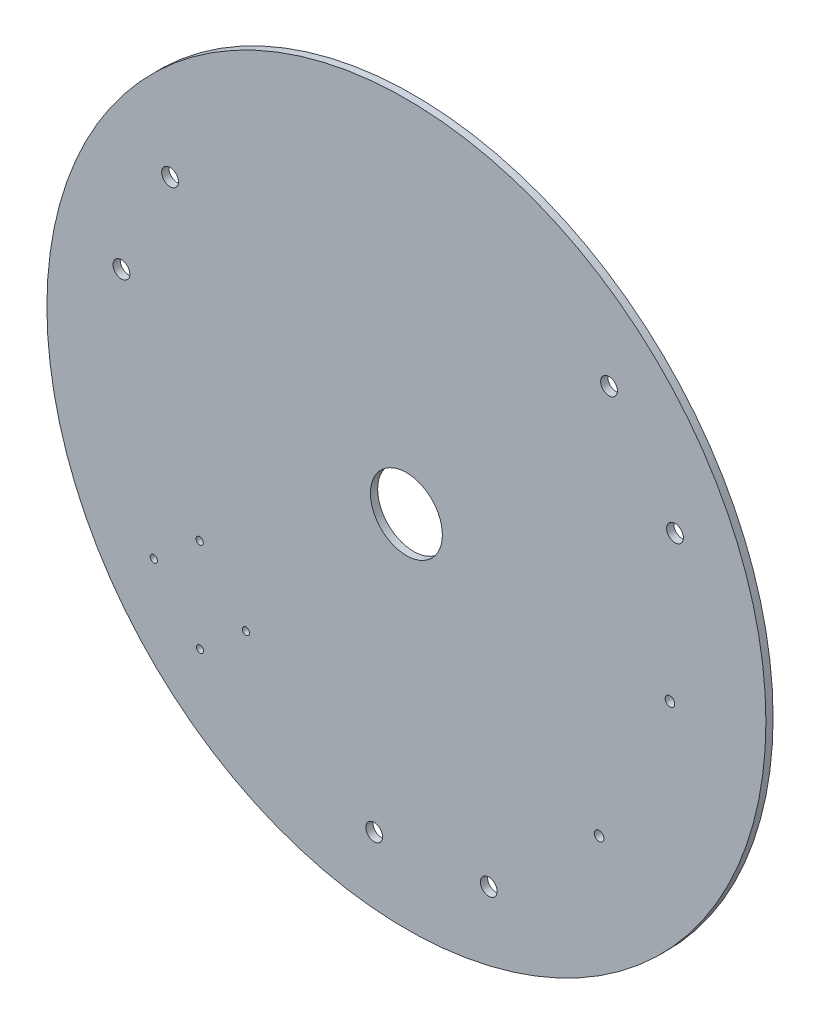
from build123d import *

# Parameters (mm, degrees)
SKETCH1_R           = 150
BOSS_EXTRUDE1_DEPTH = 3
SKETCH2_R           = 3.5
CUT_EXTRUDE1_DEPTH  = 3
CIRPATTERN1_COUNT   = 3
SKETCH3_R           = 2
CUT_EXTRUDE2_DEPTH  = 3
SKETCH4_R           = 15
CUT_EXTRUDE3_DEPTH  = 3
SKETCH6_R           = 1.5
CUT_EXTRUDE5_DEPTH  = 3


with BuildPart() as part:
    # Sketch1 → Boss-Extrude1 (new body)
    with BuildSketch(Plane.XY):
        Circle(SKETCH1_R)
    extrude(amount=BOSS_EXTRUDE1_DEPTH)

    # Sketch2 → Cut-Extrude1 (cut)
    with BuildSketch(Plane(origin=(0, 0, 0), x_dir=(-1, 0, 0), z_dir=(0, 0, -1))):
        with Locations((-84.532410842, 88.488821425)):
            Circle(SKETCH2_R)
        with Locations(Location((-112.064079787, 49.169523299, 0), (0, 0, 180))):
            Circle(SKETCH2_R)
    cut_extrude1 = extrude(amount=-CUT_EXTRUDE1_DEPTH, mode=Mode.SUBTRACT)

    # CirPattern1: Cut-Extrude1 ×3 about axis
    cirpattern1_axis = Axis((0, 0, 0), (0, 0, 1))
    for i in range(1, CIRPATTERN1_COUNT):
        add(cut_extrude1.rotate(cirpattern1_axis, i * 360 / CIRPATTERN1_COUNT), mode=Mode.SUBTRACT)

    # Sketch3 → Cut-Extrude2 (cut)
    with BuildSketch(Plane(origin=(0, 0, 0), x_dir=(-1, 0, 0), z_dir=(0, 0, -1))):
        with Locations((-109.9539568, -12.654144936)):
            Circle(SKETCH3_R)
        with Locations((-80.370678478, -76.095690029)):
            Circle(SKETCH3_R)
    extrude(amount=-CUT_EXTRUDE2_DEPTH, mode=Mode.SUBTRACT)

    # Sketch4 → Cut-Extrude3 (cut)
    with BuildSketch(Plane(origin=(0, 0, 0), x_dir=(-1, 0, 0), z_dir=(0, 0, -1))):
        Circle(SKETCH4_R)
    extrude(amount=-CUT_EXTRUDE3_DEPTH, mode=Mode.SUBTRACT)

    # Sketch6 → Cut-Extrude5 (cut)
    with BuildSketch(Plane(origin=(0, 0, 0), x_dir=(-1, 0, 0), z_dir=(0, 0, -1))):
        with Locations((66.962630167, -75.769427615)):
            Circle(SKETCH6_R)
        with Locations((86.113741245, -91.839117858)):
            Circle(SKETCH6_R)
        with Locations((105.397369535, -68.857784564)):
            Circle(SKETCH6_R)
        with Locations((86.246258457, -52.788094322)):
            Circle(SKETCH6_R)
    extrude(amount=-CUT_EXTRUDE5_DEPTH, mode=Mode.SUBTRACT)


solid = part.part
